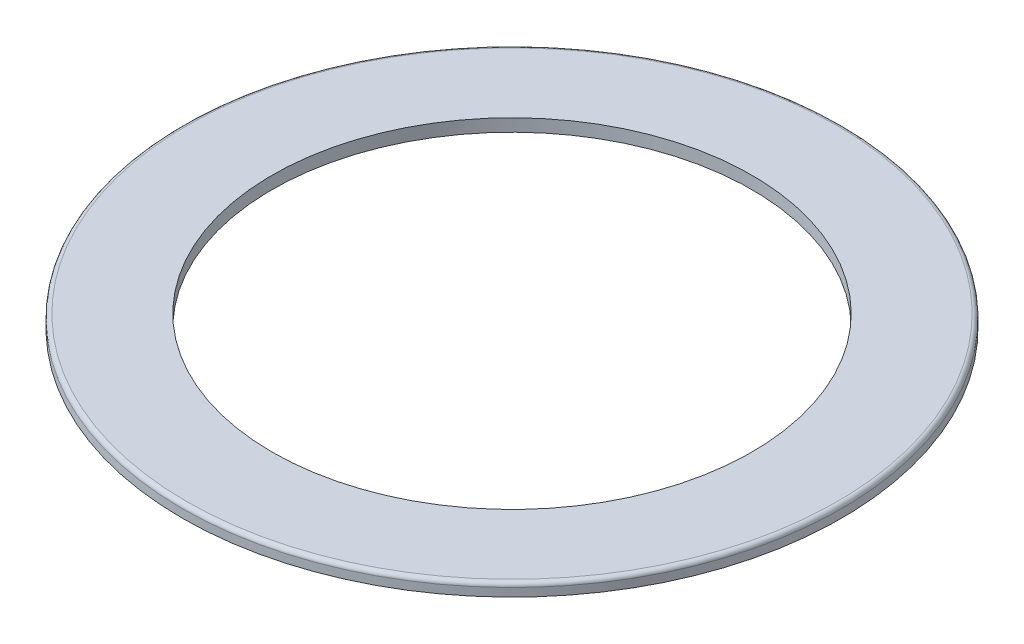
from build123d import *

# Parameters (mm, degrees)
SKETCH1_W = 2.15
SKETCH1_H = 0.3
FILLET1_R = 0.100000001


with BuildPart() as part:
    # Sketch1 → Revolve1 (revolve)
    with BuildSketch(Plane(origin=(0, 0, 0), x_dir=(-1, 0, 0), z_dir=(0, 0, -1)), mode=Mode.PRIVATE) as revolve1_sk:
        with Locations((-6.825, 0)):
            Rectangle(SKETCH1_W, SKETCH1_H)
    revolve(revolve1_sk.sketch.rotate(Axis((0, -0.15, 0), (0, 1, 0)), 270), axis=Axis((0, -0.15, 0), (0, 1, 0)))

    # Fillet1
    fillet1_edges = [part.edges().sort_by_distance(p)[0] for p in [
        (0, 0.15, -7.9),
    ]]
    fillet(fillet1_edges, radius=FILLET1_R)


solid = part.part
